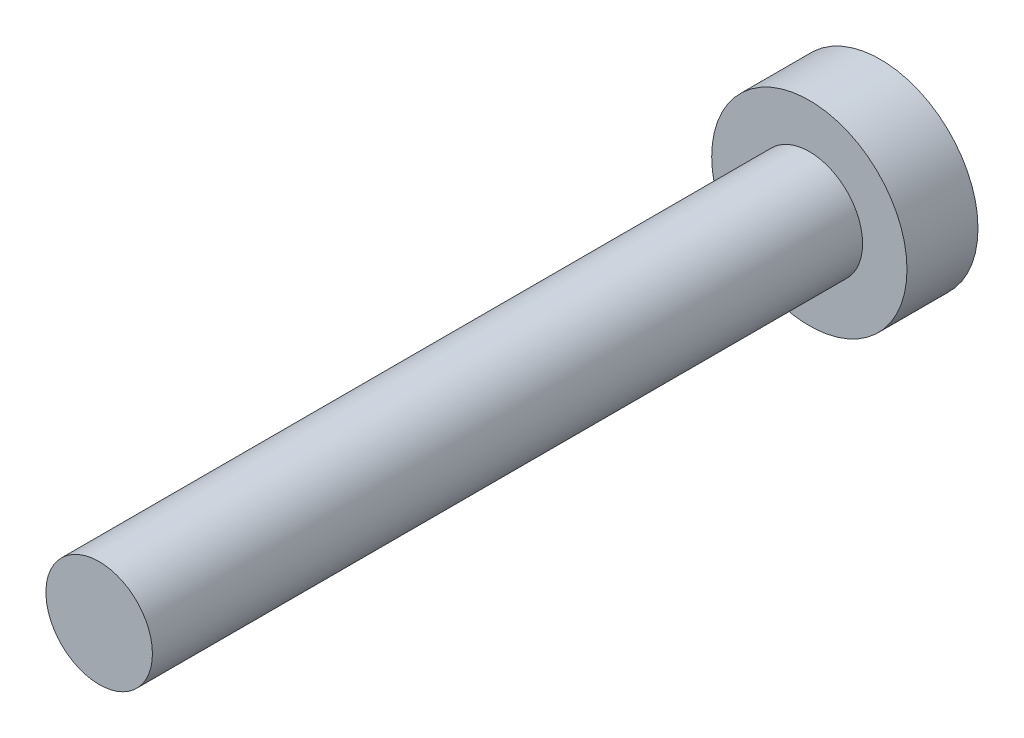
from build123d import *

# Parameters (mm, degrees)
ESQUISSE1_R        = 2.75
BOSS_EXTRU_1_DEPTH = 2
ESQUISSE2_R        = 1.5
BOSS_EXTRU_2_DEPTH = 20


with BuildPart() as part:
    # Esquisse1 → Boss.-Extru.1 (new body)
    with BuildSketch(Plane.XY):
        Circle(ESQUISSE1_R)
    extrude(amount=BOSS_EXTRU_1_DEPTH)

    # Esquisse2 → Boss.-Extru.2 (add)
    with BuildSketch(Plane.XY.offset(2)):
        Circle(ESQUISSE2_R)
    extrude(amount=BOSS_EXTRU_2_DEPTH)


solid = part.part
